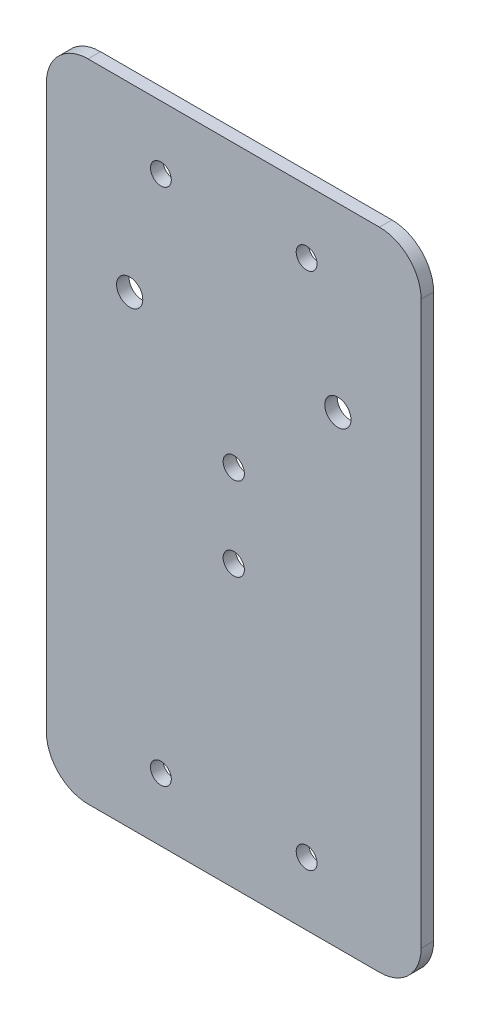
from build123d import *

# Parameters (mm, degrees)
CROQUIS1_R              = 2.5
CROQUIS1_R_2            = 2.55
CROQUIS1_R_3            = 3.15
SALIENTE_EXTRUIR1_DEPTH = 3


with BuildPart() as part:
    # Croquis1 → Saliente-Extruir1 (new body)
    with BuildSketch(Plane.XY):
        with BuildLine():
            Line((35, 77.5), (-35, 77.5))
            ThreePointArc((-35, 77.5), (-42.071067812, 74.571067812), (-45, 67.5))
            Line((-45, 67.5), (-45, -67.5))
            ThreePointArc((-45, -67.5), (-42.071067812, -74.571067812), (-35, -77.5))
            Line((-35, -77.5), (35, -77.5))
            ThreePointArc((35, -77.5), (42.071067812, -74.571067812), (45, -67.5))
            Line((45, -67.5), (45, 67.5))
            ThreePointArc((45, 67.5), (42.071067812, 74.571067812), (35, 77.5))
        make_face()
        with Locations((17.5, 62.325)):
            Circle(CROQUIS1_R, mode=Mode.SUBTRACT)
        with Locations(Location((17.5, -62.325, 0), (0, 0, 180))):
            Circle(CROQUIS1_R, mode=Mode.SUBTRACT)
        with Locations((-17.5, -62.325)):
            Circle(CROQUIS1_R, mode=Mode.SUBTRACT)
        with Locations(Location((-17.5, 62.325, 0), (0, 0, 180))):
            Circle(CROQUIS1_R, mode=Mode.SUBTRACT)
        with Locations((0, 10)):
            Circle(CROQUIS1_R_2, mode=Mode.SUBTRACT)
        with Locations(Location((0, -10, 0), (0, 0, 180))):
            Circle(CROQUIS1_R_2, mode=Mode.SUBTRACT)
        with Locations((-25, 34)):
            Circle(CROQUIS1_R_3, mode=Mode.SUBTRACT)
        with Locations(Location((25, 34, 0), (0, 0, 180))):
            Circle(CROQUIS1_R_3, mode=Mode.SUBTRACT)
    extrude(amount=SALIENTE_EXTRUIR1_DEPTH)


solid = part.part
